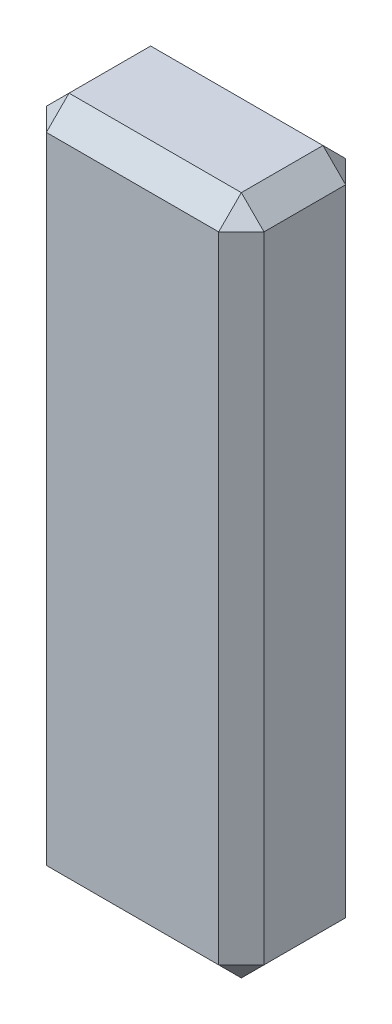
from build123d import *

# Parameters (mm, degrees)
SKETCH1_W           = 4.8
SKETCH1_H           = 2.8
BOSS_EXTRUDE1_DEPTH = 15
CHAMFER1_SIZE       = 0.5


with BuildPart() as part:
    # Sketch1 → Boss-Extrude1 (new body)
    with BuildSketch(Plane(origin=(0, 0, 0), x_dir=(1, 0, 0), z_dir=(0, 1, 0))):
        Rectangle(SKETCH1_W, SKETCH1_H)
    extrude(amount=BOSS_EXTRUDE1_DEPTH)

    # Chamfer1
    chamfer1_edges = [part.edges().sort_by_distance(p)[0] for p in [
        (-2.4, 15, 0),
        (0, 15, 1.4),
        (2.4, 15, 0),
        (0, 0, 1.4),
        (-2.4, 0, 0),
        (0, 0, -1.4),
        (2.4, 0, 0),
        (0, 15, -1.4),
        (2.4, 7.5, 1.4),
        (-2.4, 7.5, 1.4),
        (-2.4, 7.5, -1.4),
        (2.4, 7.5, -1.4),
    ]]
    chamfer(chamfer1_edges, length=CHAMFER1_SIZE)


solid = part.part
